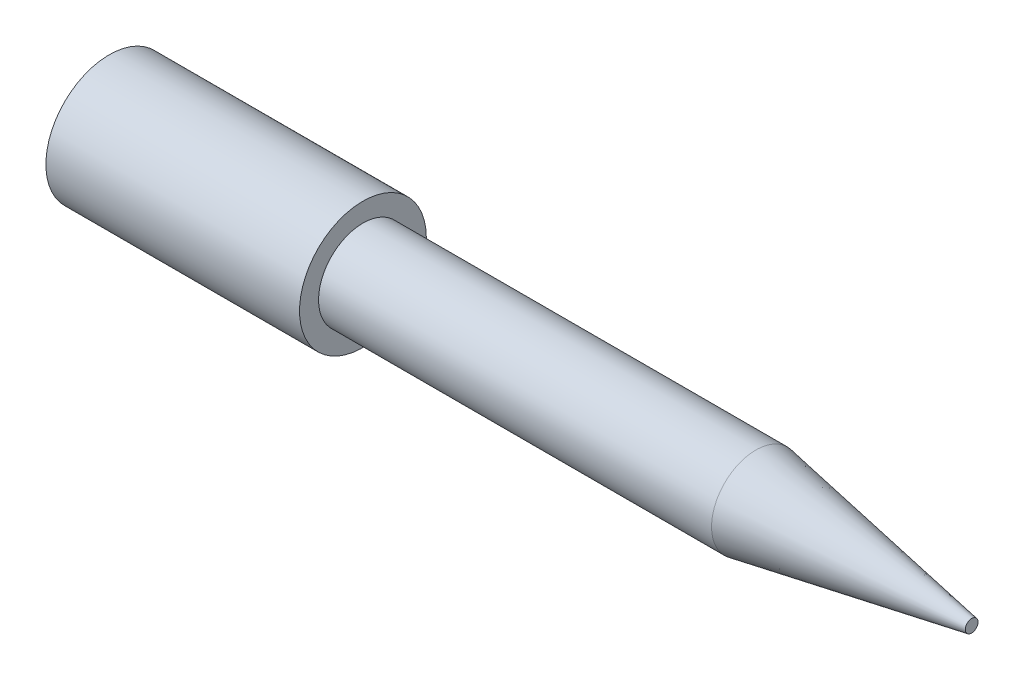
from build123d import *

# Parameters (mm, degrees)
SKETCH1_R           = 2.5
BOSS_EXTRUDE1_DEPTH = 10
SKETCH2_R           = 1.75
BOSS_EXTRUDE2_DEPTH = 24
CHAMFER1_SIZE       = 1.5
CHAMFER1_SIZE2      = 8.506922729


with BuildPart() as part:
    # Sketch1 → Boss-Extrude1 (new body)
    with BuildSketch(Plane(origin=(0, 0, 0), x_dir=(0, 0, -1), z_dir=(1, 0, 0))):
        Circle(SKETCH1_R)
    extrude(amount=BOSS_EXTRUDE1_DEPTH)

    # Sketch2 → Boss-Extrude2 (add)
    with BuildSketch(Plane(origin=(10, 0, 0), x_dir=(0, 0, -1), z_dir=(1, 0, 0))):
        Circle(SKETCH2_R)
    extrude(amount=BOSS_EXTRUDE2_DEPTH)

    # Chamfer1
    chamfer1_edges = [part.edges().sort_by_distance(p)[0] for p in [
        (34, 0, 1.75),
    ]]
    chamfer1_side = [part.faces().sort_by_distance(p)[0] for p in [
        (34, 0, 0),
    ]]
    chamfer(chamfer1_edges, length=CHAMFER1_SIZE, length2=CHAMFER1_SIZE2, reference=chamfer1_side[0])


solid = part.part
